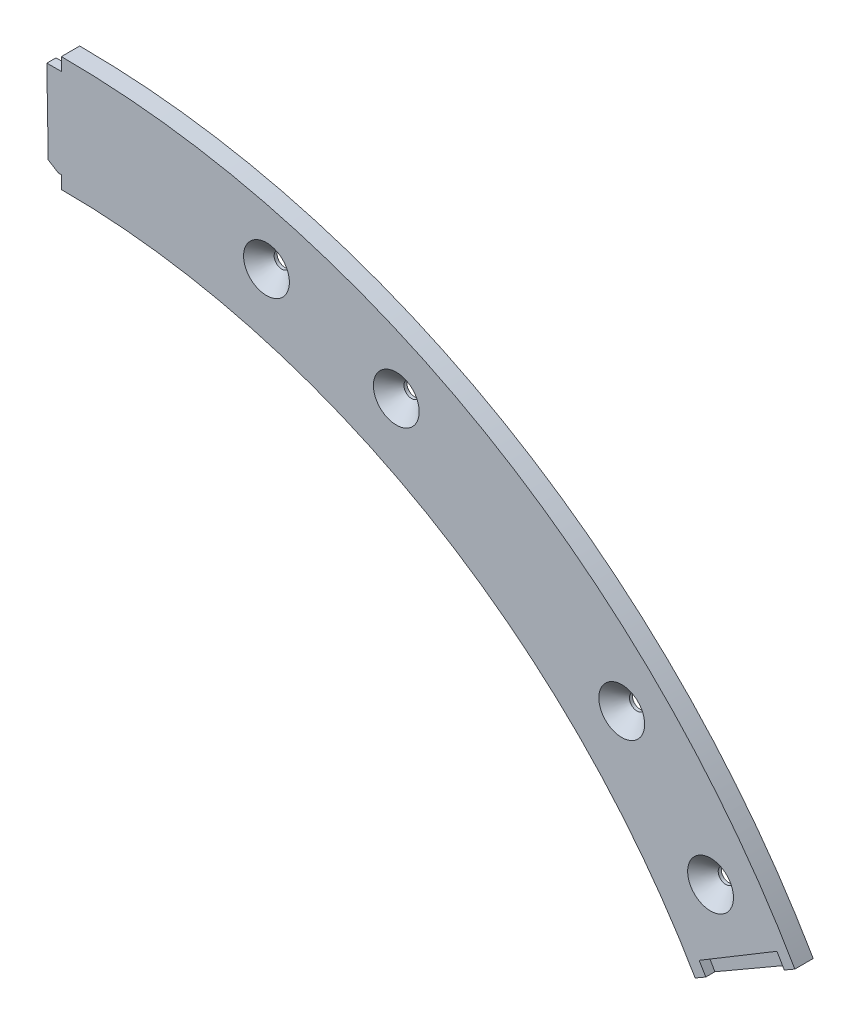
from build123d import *

# Parameters (mm, degrees)
BOSS_EXTRU_1_DEPTH                      = 6
ESQUISSE2_R                             = 2.5
ENL_V_MAT_EXTRU_1_DEPTH                 = 6
CHANFREIN1_SIZE                         = 5
ESQUISSE6_W                             = 29.69
ESQUISSE6_H                             = 3
ENL_VEMENT_DE_MATI_RE_R_VOLUTION1_ANGLE = 1
ESQUISSE7_W                             = 3
ESQUISSE7_H                             = 29.29
R_VOLUTION2_ANGLE                       = 1
ENL_V_MAT_EXTRU_2_DEPTH                 = 10


with BuildPart() as part:
    # Esquisse1 → Boss.-Extru.1 (new body)
    with BuildSketch(Plane.XY):
        with BuildLine():
            Line((0, 277.3), (0, 239.61))
            ThreePointArc((0, 239.61), (119.805, 207.508347001), (207.508347001, 119.805))
            Line((207.508347001, 119.805), (240.148844469, 138.65))
            ThreePointArc((240.148844469, 138.65), (138.65, 240.148844469), (0, 277.3))
        make_face()
    extrude(amount=BOSS_EXTRU_1_DEPTH)

    # Esquisse2 → Enlèv. mat.-Extru.1 (cut)
    with BuildSketch(Plane.XY.offset(6)):
        with Locations((67.155777633, 250.628774147)):
            Circle(ESQUISSE2_R)
        with Locations((109.656760374, 235.159681502)):
            Circle(ESQUISSE2_R)
        with Locations((212.545380932, 148.82587794)):
            Circle(ESQUISSE2_R)
        with Locations((183.472996514, 183.472996514)):
            Circle(ESQUISSE2_R)
    extrude(amount=-ENL_V_MAT_EXTRU_1_DEPTH, mode=Mode.SUBTRACT)

    # Chanfrein1
    chanfrein1_edges = [part.edges().sort_by_distance(p)[0] for p in [
        (64.655777633, 250.628774147, 6),
        (107.156760374, 235.159681502, 6),
        (180.972996514, 183.472996514, 6),
        (210.045380932, 148.82587794, 6),
    ]]
    chamfer(chanfrein1_edges, length=CHANFREIN1_SIZE)

    # Esquisse6 → Enlèvement de matière-Révolution1 (revolve, cut)
    with BuildSketch(Plane(origin=(0, 0, 0), x_dir=(0.8660254037844394, 0.49999999999999883, 0), z_dir=(0.49999999999999883, -0.8660254037844394, 0))):
        with Locations((258.455, 4.5)):
            Rectangle(ESQUISSE6_W, ESQUISSE6_H)
    revolve(axis=Axis((0, 0, 0), (0, 0, 1)), revolution_arc=ENL_VEMENT_DE_MATI_RE_R_VOLUTION1_ANGLE, mode=Mode.SUBTRACT)

    # Esquisse7 → Révolution2 (revolve)
    with BuildSketch(Plane.ZY):
        with Locations((4.5, 258.455)):
            Rectangle(ESQUISSE7_W, ESQUISSE7_H)
    revolve(axis=Axis((0, 0, 0), (0, 0, 1)), revolution_arc=R_VOLUTION2_ANGLE)

    # Esquisse8 → Enlèv. mat.-Extru.2 (cut)
    with BuildSketch(Plane.XY.offset(6)):
        Polygon((-4.291451908, 245.857115173), (-0.980595059, 243.808028033), (-4.255071213, 243.772866556), align=None)
    extrude(amount=-ENL_V_MAT_EXTRU_2_DEPTH, mode=Mode.SUBTRACT)


solid = part.part
